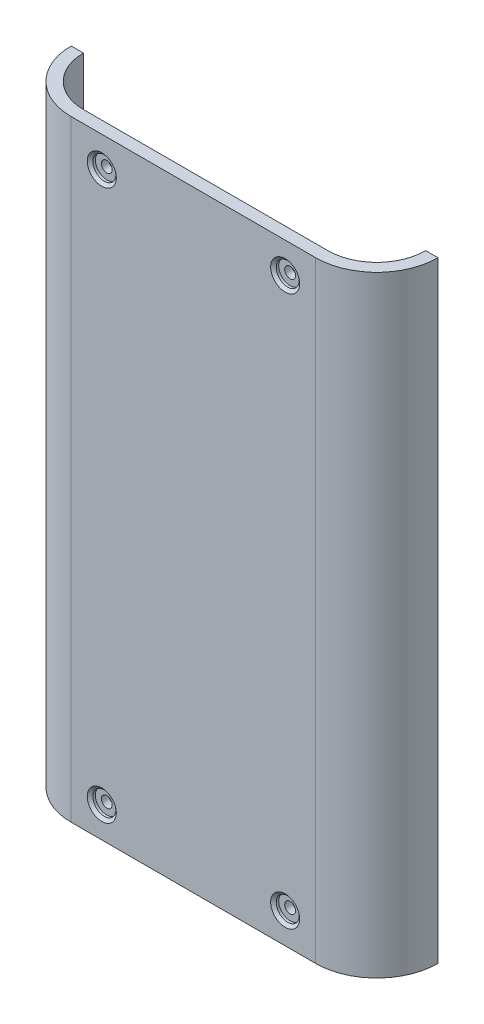
from build123d import *

# Parameters (mm, degrees)
SKETCH1_W                                   = 76.2
SKETCH1_H                                   = 76.2
BOSS_EXTRUDE1_DEPTH                         = 127
FILLET1_R                                   = 12.7
SKETCH2_W                                   = 76.2
SKETCH2_H                                   = 12.7
BOSS_EXTRUDE6_DEPTH                         = 57.15
CUT_EXTRUDE2_DEPTH                          = 12.7
CUT_EXTRUDE4_START                          = -254
CUT_EXTRUDE4_DEPTH                          = 254
SKETCH7_W                                   = 50.8
SKETCH7_H                                   = 10.16
CUT_EXTRUDE7_DEPTH                          = 124.46
CUT_EXTRUDE8_DEPTH                          = 114.3
BOSS_EXTRUDE7_DEPTH                         = 12.7
CUT_EXTRUDE9_DEPTH                          = 127
CBORE_FOR_1_BINDING_HEAD_MACHINE_SC_2_COUNT = 2
CBORE_FOR_1_BINDING_HEAD_MACHINE_SC_2_PITCH = 38.1
CBORE_FOR_1_BINDING_HEAD_MACHINE_SC_3_COUNT = 2
CBORE_FOR_1_BINDING_HEAD_MACHINE_SC_3_PITCH = 114.3
CBORE_FOR_1_BINDING_HEAD_MACHINE_SC_4_COUNT = 2
CBORE_FOR_1_BINDING_HEAD_MACHINE_SC_4_PITCH = 120.482778852


with BuildPart() as part:
    # Sketch1 → Boss-Extrude1 (new body)
    with BuildSketch(Plane(origin=(0, 0, 0), x_dir=(1, 0, 0), z_dir=(0, 1, 0))):
        Rectangle(SKETCH1_W, SKETCH1_H)
    extrude(amount=BOSS_EXTRUDE1_DEPTH)

    # Fillet1
    fillet1_edges = [part.edges().sort_by_distance(p)[0] for p in [
        (38.1, 63.5, 38.1),
        (38.1, 63.5, -38.1),
        (-38.1, 63.5, -38.1),
        (-38.1, 63.5, 38.1),
    ]]
    fillet(fillet1_edges, radius=FILLET1_R)

    # Sketch2 → Boss-Extrude6 (add)
    with BuildSketch(Plane(origin=(0, 127, 0), x_dir=(1, 0, 0), z_dir=(0, 1, 0))):
        Rectangle(SKETCH2_W, SKETCH2_H)
    extrude(amount=BOSS_EXTRUDE6_DEPTH)

    # Sketch5 → Cut-Extrude2 (cut)
    with BuildSketch(Plane.XY.offset(6.35)):
        with BuildLine():
            ThreePointArc((27.94, 127), (0, 146.05), (-27.94, 127))
            Line((-27.94, 127), (27.94, 127))
        make_face()
        with BuildLine():
            Line((-27.94, 146.05), (-27.94, 132.743180509))
            ThreePointArc((-27.94, 132.743180509), (-21.337126939, 140.622484939), (-12.60652265, 146.05))
            Line((-12.60652265, 146.05), (-27.94, 146.05))
        make_face()
        with BuildLine():
            ThreePointArc((12.60652265, 146.05), (21.337126939, 140.622484939), (27.94, 132.743180509))
            Line((27.94, 132.743180509), (27.94, 146.05))
            Line((27.94, 146.05), (12.60652265, 146.05))
        make_face()
        with BuildLine():
            Line((-38.1, 184.15), (-38.1, 146.05))
            ThreePointArc((-38.1, 146.05), (-26.940768363, 172.990768363), (0, 184.15))
            Line((0, 184.15), (-38.1, 184.15))
        make_face()
        with BuildLine():
            ThreePointArc((0, 184.15), (26.940768363, 172.990768363), (38.1, 146.05))
            Line((38.1, 146.05), (38.1, 184.15))
            Line((38.1, 184.15), (0, 184.15))
        make_face()
        with BuildLine():
            Line((-27.186811297, 152.493670653), (27.186811297, 152.493670653))
            ThreePointArc((27.186811297, 152.493670653), (0, 173.99), (-27.186811297, 152.493670653))
        make_face()
    extrude(amount=-CUT_EXTRUDE2_DEPTH, mode=Mode.SUBTRACT)

    # Sketch6 → Cut-Extrude4 (cut)
    with BuildSketch(Plane.XZ.offset(CUT_EXTRUDE4_START)):
        with BuildLine():
            Line((-38.1, 25.4), (-38.1, -25.4))
            ThreePointArc((-38.1, -25.4), (-34.380256121, -34.380256121), (-25.4, -38.1))
            Line((-25.4, -38.1), (25.4, -38.1))
            ThreePointArc((25.4, -38.1), (34.380256121, -34.380256121), (38.1, -25.4))
            Line((38.1, -25.4), (38.1, 25.4))
            Line((38.1, 25.4), (-38.1, 25.4))
        make_face()
    extrude(amount=CUT_EXTRUDE4_DEPTH, mode=Mode.SUBTRACT)

    # Sketch7 → Cut-Extrude7 (cut)
    with BuildSketch(Plane.XZ):
        with Locations((0, 30.48)):
            Rectangle(SKETCH7_W, SKETCH7_H)
    extrude(amount=-CUT_EXTRUDE7_DEPTH, mode=Mode.SUBTRACT)

    # Sketch7<6> → Cut-Extrude8 (cut)
    with BuildSketch(Plane.XZ):
        with BuildLine():
            ThreePointArc((-25.4, 35.56), (-32.584204897, 32.584204897), (-35.56, 25.4))
            Line((-35.56, 25.4), (-25.4, 25.4))
            Line((-25.4, 25.4), (-25.4, 35.56))
        make_face()
        with BuildLine():
            Line((25.4, 35.56), (25.4, 25.4))
            Line((25.4, 25.4), (35.56, 25.4))
            ThreePointArc((35.56, 25.4), (32.584204897, 32.584204897), (25.4, 35.56))
        make_face()
    extrude(amount=-CUT_EXTRUDE8_DEPTH, mode=Mode.SUBTRACT)

    # Sketch7<7> → Boss-Extrude7 (add)
    with BuildSketch(Plane.XZ):
        with BuildLine():
            ThreePointArc((-25.4, 35.56), (-32.584204897, 32.584204897), (-35.56, 25.4))
            Line((-35.56, 25.4), (-25.4, 25.4))
            Line((-25.4, 25.4), (-25.4, 35.56))
        make_face()
        with BuildLine():
            Line((25.4, 35.56), (25.4, 25.4))
            Line((25.4, 25.4), (35.56, 25.4))
            ThreePointArc((35.56, 25.4), (32.584204897, 32.584204897), (25.4, 35.56))
        make_face()
    extrude(amount=-BOSS_EXTRUDE7_DEPTH)

    # Sketch7<8> → Cut-Extrude9 (cut)
    with BuildSketch(Plane.XZ):
        with BuildLine():
            ThreePointArc((-25.4, 35.56), (-32.584204897, 32.584204897), (-35.56, 25.4))
            Line((-35.56, 25.4), (35.56, 25.4))
            ThreePointArc((35.56, 25.4), (32.584204897, 32.584204897), (25.4, 35.56))
            Line((25.4, 35.56), (-25.4, 35.56))
        make_face()
    extrude(amount=-CUT_EXTRUDE9_DEPTH, mode=Mode.SUBTRACT)

    # Sketch12 → CBORE for #1 Binding Head Machine Screw1 (revolve, cut)
    with BuildSketch(Plane(origin=(-19.05, 120.65, 38.1), x_dir=(0, -1, 0), z_dir=(1, 0, 0))):
        Polygon((0, 0), (0, 10.839152758), (1.1303, 10.16), (1.1303, 1.0414), (2.38125, 1.0414), (2.38125, 0.532828266), (3.01625, 0), align=None)
    cbore_for_1_binding_head_machine_screw1 = revolve(axis=Axis((-19.05, 120.65, 44.45), (0, 0, -1)), mode=Mode.SUBTRACT)

    # CBORE for _1 Binding Head Machine Sc 2: CBORE for #1 Binding Head Machine Screw1 ×2
    with Locations(*[(i * CBORE_FOR_1_BINDING_HEAD_MACHINE_SC_2_PITCH, 0, 0) for i in range(1, CBORE_FOR_1_BINDING_HEAD_MACHINE_SC_2_COUNT)]):
        add(cbore_for_1_binding_head_machine_screw1, mode=Mode.SUBTRACT)

    # CBORE for _1 Binding Head Machine Sc 3: CBORE for #1 Binding Head Machine Screw1 ×2
    with Locations(*[(0, -i * CBORE_FOR_1_BINDING_HEAD_MACHINE_SC_3_PITCH, 0) for i in range(1, CBORE_FOR_1_BINDING_HEAD_MACHINE_SC_3_COUNT)]):
        add(cbore_for_1_binding_head_machine_screw1, mode=Mode.SUBTRACT)

    # CBORE for _1 Binding Head Machine Sc 4: CBORE for #1 Binding Head Machine Screw1 ×2
    with Locations(*[Vector(0.3162277660168378, -0.9486832980505139, 0) * (i * CBORE_FOR_1_BINDING_HEAD_MACHINE_SC_4_PITCH) for i in range(1, CBORE_FOR_1_BINDING_HEAD_MACHINE_SC_4_COUNT)]):
        add(cbore_for_1_binding_head_machine_screw1, mode=Mode.SUBTRACT)


solid = part.part
